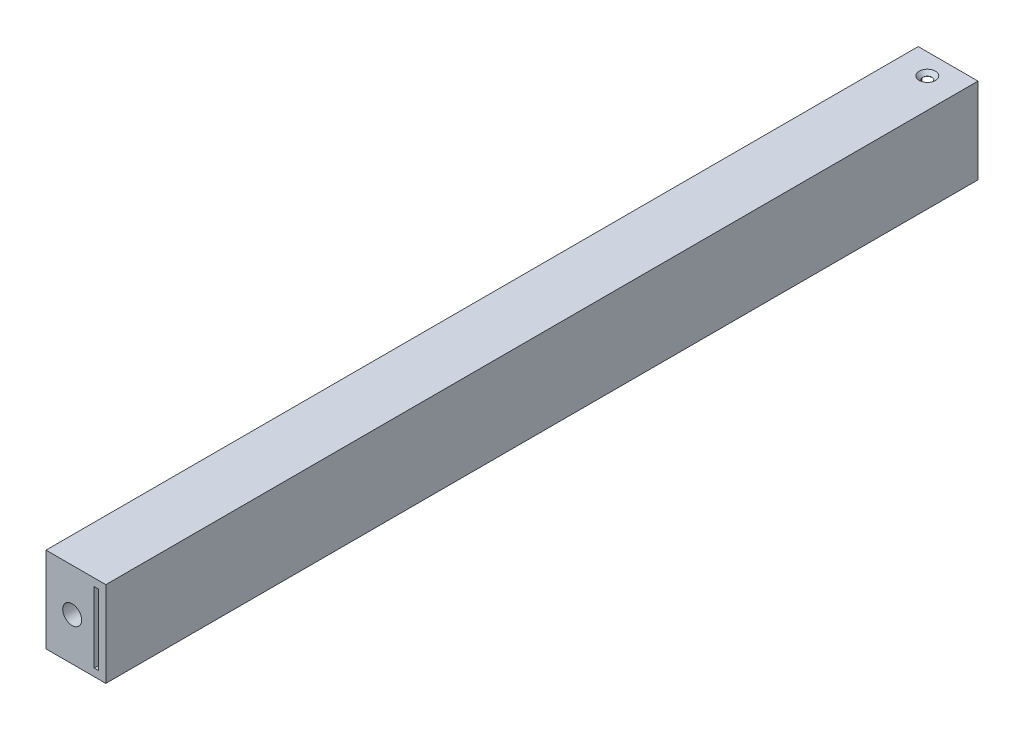
from build123d import *

# Parameters (mm, degrees)
SKETCH2_W        = 14.4
SKETCH2_H        = 20.6
SKETCH2_W_2      = 1
SKETCH2_H_2      = 17
TOP_DEPTH        = 3.2
SKETCH3_W        = 14.4
SKETCH3_H        = 20.6
SKETCH3_W_2      = 10.8
SKETCH3_H_2      = 17
BODY_DEPTH       = 196.8
SKETCH4_W        = 14.4
SKETCH4_H        = 20.6
SKETCH4_W_2      = 12.62
SKETCH4_H_2      = 18.82
INSERT_DEPTH     = 10
SKETCH5_W        = 0.8
SKETCH5_H        = 17
FLEX_DEPTH       = 196.8
SERVO_GEAR_REACH = 212.408
SKETCH9_R        = 2.275
CHAMFER1_SIZE    = 4


with BuildPart() as part:
    # Sketch2 → Top (new body)
    with BuildSketch(Plane.XY):
        with Locations((0.9, 0)):
            Rectangle(SKETCH2_W, SKETCH2_H)
        with Locations((5.8, 0)):
            Rectangle(SKETCH2_W_2, SKETCH2_H_2, mode=Mode.SUBTRACT)
    extrude(amount=-TOP_DEPTH)

    # Sketch3 → Body (add)
    with BuildSketch(Plane(origin=(0, 0, -3.2), x_dir=(-1, 0, 0), z_dir=(0, 0, -1))):
        with Locations((-0.9, 0)):
            Rectangle(SKETCH3_W, SKETCH3_H)
        with Locations((-0.9, 0)):
            Rectangle(SKETCH3_W_2, SKETCH3_H_2, mode=Mode.SUBTRACT)
    extrude(amount=BODY_DEPTH)

    # Sketch4 → Insert (add)
    with BuildSketch(Plane(origin=(0, 0, -200), x_dir=(-1, 0, 0), z_dir=(0, 0, -1))):
        with Locations((-0.9, 0)):
            Rectangle(SKETCH4_W, SKETCH4_H)
        with Locations((-0.9, 0)):
            Rectangle(SKETCH4_W_2, SKETCH4_H_2, mode=Mode.SUBTRACT)
    extrude(amount=INSERT_DEPTH)

    # Sketch5 → Flex (add)
    with BuildSketch(Plane(origin=(0, 0, -3.2), x_dir=(-1, 0, 0), z_dir=(0, 0, -1))):
        with Locations((-4.9, 0)):
            Rectangle(SKETCH5_W, SKETCH5_H)
    extrude(amount=FLEX_DEPTH)

    # Sketch9 → Servo gear (cut, up to next)
    with BuildSketch(Plane.XY, mode=Mode.PRIVATE) as servo_gear_sk1:
        Circle(SKETCH9_R)
    servo_gear_tool1 = extrude(servo_gear_sk1.sketch, amount=-SERVO_GEAR_REACH, mode=Mode.PRIVATE) & part.part
    add(servo_gear_tool1.solids().sort_by_distance((0, 0, 0))[0], mode=Mode.SUBTRACT)

    # Sketch15 → CSK for M2 Flat Head Machine Screw2 (revolve, cut)
    with BuildSketch(Plane(origin=(0.9, -10.3, -205), x_dir=(0, 0, -1), z_dir=(1, 0, 0))):
        Polygon((0, 0), (0, 0.89), (1.1, 0.89), (1.1, 0.85), (1.95, 0), align=None)
    revolve(axis=Axis((0.9, -16.65, -205), (0, 1, 0)), mode=Mode.SUBTRACT)

    # Sketch18 → CSK for M2 Flat Head Machine Screw3 (revolve, cut)
    with BuildSketch(Plane(origin=(0.9, 10.3, -205), x_dir=(0, 0, 1), z_dir=(1, 0, 0))):
        Polygon((0, 0), (0, 0.89), (1.1, 0.89), (1.1, 0.85), (1.95, 0), align=None)
    revolve(axis=Axis((0.9, 16.65, -205), (0, -1, 0)), mode=Mode.SUBTRACT)

    # Chamfer1
    chamfer1_edges = [part.edges().sort_by_distance(p)[0] for p in [
        (-4.5, -8.5, -101.6),
        (-4.5, 8.5, -101.6),
        (4.5, 8.5, -101.6),
        (4.5, -8.5, -101.6),
    ]]
    chamfer(chamfer1_edges, length=CHAMFER1_SIZE)


solid = part.part
